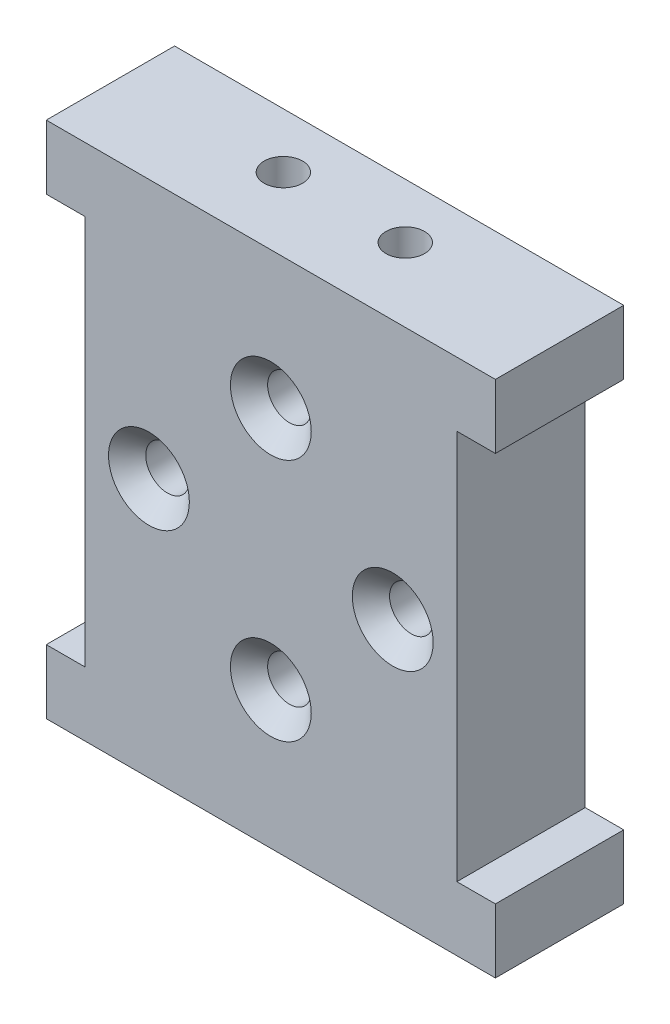
from build123d import *

# Parameters (mm, degrees)
BOSS_EXTRUDE1_DEPTH                             = 5
CSK_FOR_M3_FLAT_HEAD_MACHINE_SCREW1_D           = 3.4
CSK_FOR_M3_FLAT_HEAD_MACHINE_SCREW1_DEPTH       = 15.4
CSK_FOR_M3_FLAT_HEAD_MACHINE_SCREW1_CSINK_D     = 6.3
CSK_FOR_M3_FLAT_HEAD_MACHINE_SCREW1_CSINK_ANGLE = 90
CSK_FOR_M3_FLAT_HEAD_MACHINE_SCREW1_TIP         = 1.041353257
F_3_0MM_DOWEL_HOLE1_D                           = 3


with BuildPart() as part:
    # Sketch2 → Boss-Extrude1 (new, symmetric)
    with BuildSketch(Plane.XY):
        Polygon((-14.5, -15.2), (-14.5, 15.2), (-17.5, 15.2), (-17.5, 20.2), (17.5, 20.2), (17.5, 15.2), (14.5, 15.2), (14.5, -15.2), (17.5, -15.2), (17.5, -20.2), (-17.5, -20.2), (-17.5, -15.2), align=None)
    extrude(amount=BOSS_EXTRUDE1_DEPTH, both=True)

    # CSK for M3 Flat Head Machine Screw1
    with Locations(Plane(origin=(-9.5, 0, 5), x_dir=(1, 0, 0), z_dir=(0, 0, 1))):
        with Locations((0, 0), (9.5, 9.5), (19, 0), (9.5, -9.5)):
            CounterSinkHole(CSK_FOR_M3_FLAT_HEAD_MACHINE_SCREW1_D / 2, CSK_FOR_M3_FLAT_HEAD_MACHINE_SCREW1_CSINK_D / 2, depth=CSK_FOR_M3_FLAT_HEAD_MACHINE_SCREW1_DEPTH, counter_sink_angle=CSK_FOR_M3_FLAT_HEAD_MACHINE_SCREW1_CSINK_ANGLE)
            with Locations((0, 0, -(CSK_FOR_M3_FLAT_HEAD_MACHINE_SCREW1_DEPTH + CSK_FOR_M3_FLAT_HEAD_MACHINE_SCREW1_TIP / 2))):  # 117.02° drill point
                Cone(0, CSK_FOR_M3_FLAT_HEAD_MACHINE_SCREW1_D / 2, CSK_FOR_M3_FLAT_HEAD_MACHINE_SCREW1_TIP, mode=Mode.SUBTRACT)

    # Ø3.0mm Dowel Hole1 (through all)
    with Locations(Plane(origin=(0, 20.2, 0), x_dir=(1, 0, 0), z_dir=(0, 1, 0))):
        with Locations((-4.75, 0.725), (4.75, 0.725)):
            Hole(F_3_0MM_DOWEL_HOLE1_D / 2)


solid = part.part
